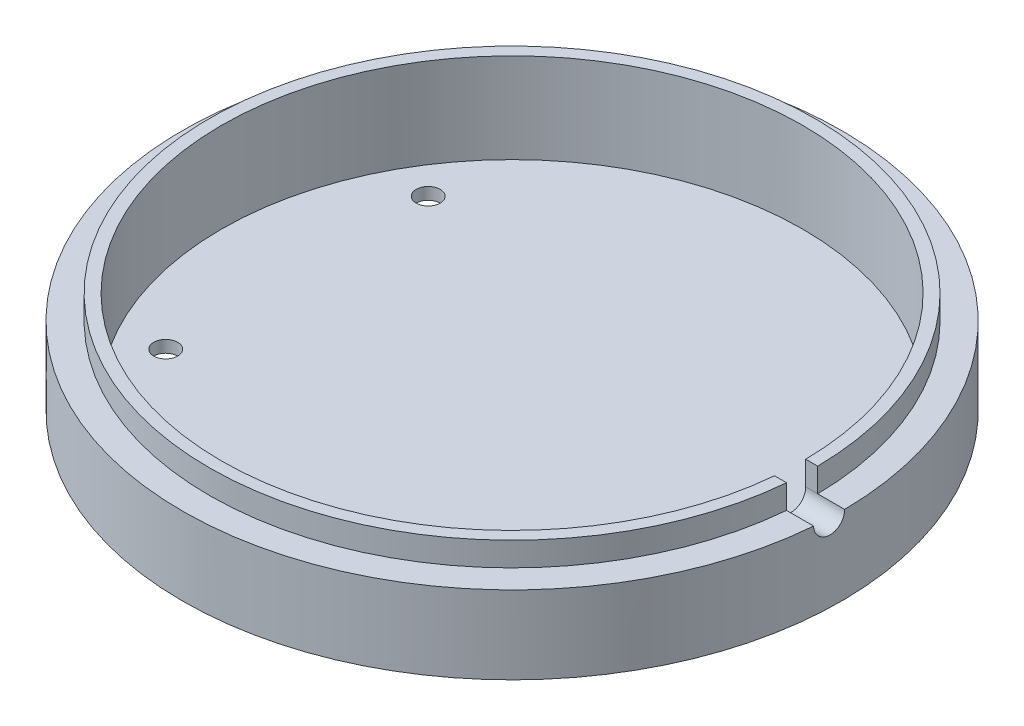
from build123d import *

# Parameters (mm, degrees)
SKETCH2_R                = 55
BOSS_EXTRUDE2_DEPTH      = 13
SKETCH7_R                = 50.5
BOSS_EXTRUDE3_DEPTH      = 4
SKETCH8_R                = 48.5
CUT_EXTRUDE3_DEPTH       = 15
SKETCH9_R                = 2
SKETCH9_W                = 3.162660916
SKETCH9_H                = 2.60493009
CUT_EXTRUDE4_DEPTH       = 15
CUT_EXTRUDE5_DEPTH       = 20
CUT_EXTRUDE5_DEPTH_BACK  = 1
SKETCH10_R               = 2.5
BOSS_EXTRUDE5_DEPTH      = 0.01
BOSS_EXTRUDE5_DEPTH_BACK = 2
SKETCH11_W               = 6.274273212
SKETCH11_H               = 7.379534018
CUT_EXTRUDE6_REACH       = 81.618
CUT_EXTRUDE6_END_RADIUS  = 50.5
SKETCH13_W               = 5
SKETCH13_H               = 6.11505402


with BuildPart() as part:
    # Sketch2 → Boss-Extrude2 (new body)
    with BuildSketch(Plane(origin=(0, 0, 0), x_dir=(1, 0, 0), z_dir=(0, 1, 0))):
        with Locations(Location((0, 0, 0), (0, 0, 90))):
            Circle(SKETCH2_R)
    extrude(amount=BOSS_EXTRUDE2_DEPTH)

    # Sketch7 → Boss-Extrude3 (add)
    with BuildSketch(Plane(origin=(0, 13, 0), x_dir=(1, 0, 0), z_dir=(0, 1, 0))):
        with Locations(Location((0, 0, 0), (0, 0, 270))):
            Circle(SKETCH7_R)
    extrude(amount=BOSS_EXTRUDE3_DEPTH)

    # Sketch8 → Cut-Extrude3 (cut)
    with BuildSketch(Plane(origin=(0, 17, 0), x_dir=(1, 0, 0), z_dir=(0, 1, 0))):
        with Locations(Location((0, 0, 0), (0, 0, 270))):
            Circle(SKETCH8_R)
    extrude(amount=-CUT_EXTRUDE3_DEPTH, mode=Mode.SUBTRACT)

    # Sketch9 → Cut-Extrude4 (cut)
    with BuildSketch(Plane(origin=(0, 2, 0), x_dir=(1, 0, 0), z_dir=(0, 1, 0))):
        with Locations(Location((36, -22, 0), (0, 0, 270))):
            Circle(SKETCH9_R)
        with Locations(Location((-36, 22, 0), (0, 0, 270))):
            Circle(SKETCH9_R)
        with Locations(Location((-35.8, -22, 0), (0, 0, 270))):
            Circle(SKETCH9_R)
        with Locations(Location((36, 22, 0), (0, 0, 270))):
            Circle(SKETCH9_R)
        with Locations((37.581330458, -0.802465045)):
            Rectangle(SKETCH9_W, SKETCH9_H)
    extrude(amount=-CUT_EXTRUDE4_DEPTH, mode=Mode.SUBTRACT)

    # Sketch10 → Cut-Extrude5 (cut, two sides: drawn at the far end of the back side and taken through both)
    with BuildSketch(Plane(origin=(36, 0, 0), x_dir=(0, 0, -1), z_dir=(1, 0, 0)).offset(-CUT_EXTRUDE5_DEPTH_BACK)):
        with Locations(Location((-2, 13, 0), (0, 0, 180))):
            Circle(SKETCH10_R)
    extrude(amount=CUT_EXTRUDE5_DEPTH + CUT_EXTRUDE5_DEPTH_BACK, mode=Mode.SUBTRACT)

    # Sketch11 → Boss-Extrude5 (add, two sides: drawn at the far end of the back side and taken through both)
    with BuildSketch(Plane(origin=(0, 2, 0), x_dir=(1, 0, 0), z_dir=(0, 1, 0)).offset(-BOSS_EXTRUDE5_DEPTH_BACK)):
        with Locations((37.193701051, -0.388212482)):
            Rectangle(SKETCH11_W, SKETCH11_H)
    extrude(amount=BOSS_EXTRUDE5_DEPTH + BOSS_EXTRUDE5_DEPTH_BACK)

    # Cut-Extrude6: up to this cylinder (the profile starts inside it)
    cut_extrude6_end = Plane(origin=(0, 16.057527, 0), z_dir=(0, -1, 0)) * Cylinder(CUT_EXTRUDE6_END_RADIUS, 265.236, mode=Mode.PRIVATE)
    # Sketch13 → Cut-Extrude6 (cut, up to the surface)
    with BuildSketch(Plane(origin=(0, 0, 0), x_dir=(0, 0, -1), z_dir=(1, 0, 0)), mode=Mode.PRIVATE) as cut_extrude6_sk1:
        with Locations((-2, 16.05752701)):
            Rectangle(SKETCH13_W, SKETCH13_H)
    cut_extrude6_tool1 = extrude(cut_extrude6_sk1.sketch, amount=CUT_EXTRUDE6_REACH, mode=Mode.PRIVATE) & cut_extrude6_end
    add(cut_extrude6_tool1.solids().sort_by_distance((0, 16.057527, 2))[0], mode=Mode.SUBTRACT)


solid = part.part
